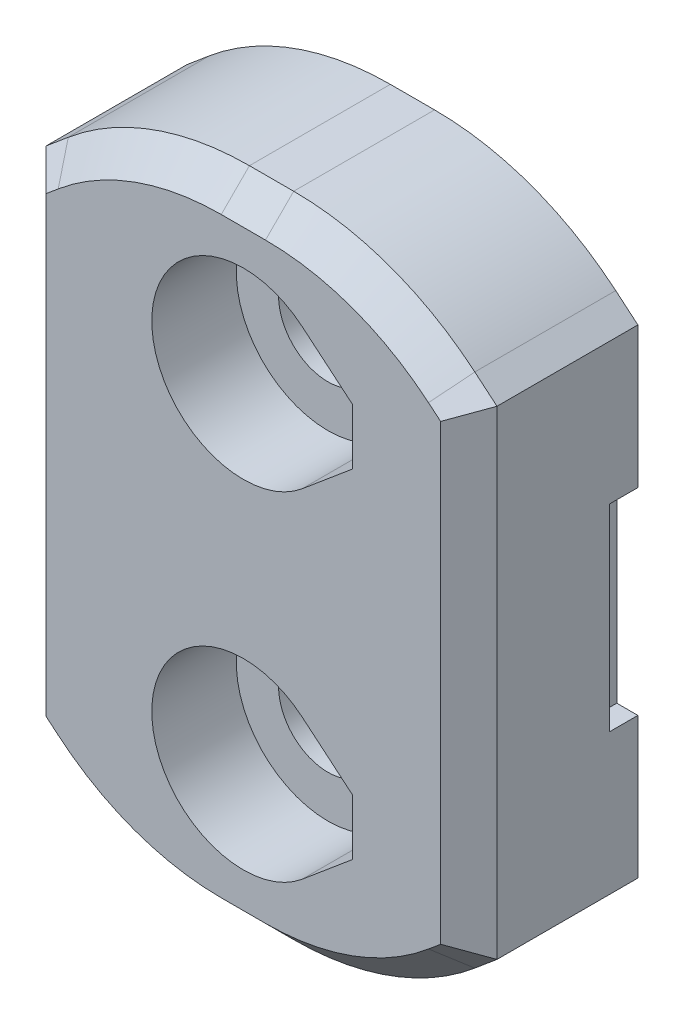
from build123d import *
from OCP.BRepFilletAPI import BRepFilletAPI_MakeChamfer

# Parameters (mm, degrees)
CROQUIS2_W              = 16
CROQUIS2_H              = 23
SALIENTE_EXTRUIR1_DEPTH = 6
CORTAR_EXTRUIR1_DEPTH   = 3
CHAFL_N2_SIZE           = 3
CHAFL_N2_SIZE2          = 3.575260778
REDONDEO1_R             = 10
CHAFL_N1_SIZE           = 1
CROQUIS4_W              = 16
CROQUIS4_H              = 7
CORTAR_EXTRUIR2_DEPTH   = 1
SALIENTE_EXTRUIR2_DEPTH = 7
MATRIZL1_COUNT          = 8
MATRIZL1_PITCH          = 2


with BuildPart() as part:
    # Croquis2 → Saliente-Extruir1 (new body)
    with BuildSketch(Plane(origin=(0, 0, 0), x_dir=(-1, 0, 0), z_dir=(0, 0, -1))):
        with Locations((-8, 11.5)):
            Rectangle(CROQUIS2_W, CROQUIS2_H)
        with BuildLine():
            Line((-9.977670702, 6.125), (-9.977670702, 4.875))
            Line((-9.977670702, 4.875), (-9.124878317, 4.159422225))
            ThreePointArc((-9.124878317, 4.159422225), (-6.25, 5.5), (-9.124878317, 6.840577775))
            Line((-9.124878317, 6.840577775), (-9.977670702, 6.125))
        make_face(mode=Mode.SUBTRACT)
        with BuildLine():
            Line((-9.977670702, 18.125), (-9.977670702, 16.875))
            Line((-9.977670702, 16.875), (-9.124878317, 16.159422225))
            ThreePointArc((-9.124878317, 16.159422225), (-6.25, 17.5), (-9.124878317, 18.840577775))
            Line((-9.124878317, 18.840577775), (-9.977670702, 18.125))
        make_face(mode=Mode.SUBTRACT)
    extrude(amount=SALIENTE_EXTRUIR1_DEPTH)

    # Croquis3 → Cortar-Extruir1 (cut)
    with BuildSketch(Plane(origin=(-8, 0, 0), x_dir=(-1, 0, 0), z_dir=(0, 0, -1))):
        with BuildLine():
            Line((-19.864348845, 6.5), (-19.864348845, 4.5))
            Line((-19.864348845, 4.5), (-18.089059731, 3.01035556))
            ThreePointArc((-18.089059731, 3.01035556), (-12.75, 5.5), (-18.089059731, 7.98964444))
            Line((-18.089059731, 7.98964444), (-19.864348845, 6.5))
        make_face()
        with BuildLine():
            Line((-19.864348845, 18.5), (-18.089059731, 19.98964444))
            ThreePointArc((-18.089059731, 19.98964444), (-12.75, 17.5), (-18.089059731, 15.01035556))
            Line((-18.089059731, 15.01035556), (-19.864348845, 16.5))
            Line((-19.864348845, 16.5), (-19.864348845, 18.5))
        make_face()
    extrude(amount=CORTAR_EXTRUIR1_DEPTH, mode=Mode.SUBTRACT)

    # Chaflán2: one chamfer whose edges measure the first distance from different faces: ONE call of the kernel's chamfer builder (chamfer() names one face for all edges)
    chafl_n2_edges_1 = [part.edges().sort_by_distance(p)[0] for p in [
        (16, 23, -3),
        (16, 0, -3),
    ]]
    chafl_n2_side_1 = [part.faces().sort_by_distance(p)[0] for p in [
        (16, 11.5, -3),
    ]]
    chafl_n2_edges_2 = [part.edges().sort_by_distance(p)[0] for p in [
        (0, 23, -3),
        (0, 0, -3),
    ]]
    chafl_n2_side_2 = [part.faces().sort_by_distance(p)[0] for p in [
        (0, 11.5, -3),
    ]]
    chafl_n2 = BRepFilletAPI_MakeChamfer(part.part.solid().wrapped)
    for e in chafl_n2_edges_1:
        chafl_n2.Add(CHAFL_N2_SIZE, CHAFL_N2_SIZE2, e.wrapped, chafl_n2_side_1[0].wrapped)  # the first distance lies on this face
    for e in chafl_n2_edges_2:
        chafl_n2.Add(CHAFL_N2_SIZE, CHAFL_N2_SIZE2, e.wrapped, chafl_n2_side_2[0].wrapped)  # the first distance lies on this face
    add(Compound.cast(chafl_n2.Shape()), mode=Mode.REPLACE)

    # Redondeo1
    redondeo1_edges = [part.edges().sort_by_distance(p)[0] for p in [
        (3.575260778, 23, -3),
        (12.424739222, 23, -3),
        (3.575260778, 0, -3),
        (12.424739222, 0, -3),
    ]]
    fillet(redondeo1_edges, radius=REDONDEO1_R)

    # Chaflán1
    chafl_n1_edges = [part.edges().sort_by_distance(p)[0] for p in [
        (8, 0, 0),
        (8, 23, 0),
        (0.393543512, 20.330222216, 0),
        (15.606456488, 2.669777784, 0),
        (3.794761687, 22.396926208, 0),
        (12.205238313, 22.396926208, 0),
        (12.205238313, 0.603073792, 0),
        (3.794761687, 0.603073792, 0),
        (16, 11.5, 0),
        (0, 11.5, 0),
        (0.393543512, 2.669777784, 0),
        (15.606456488, 20.330222216, 0),
    ]]
    chamfer(chafl_n1_edges, length=CHAFL_N1_SIZE)

    # Croquis4 → Cortar-Extruir2 (cut)
    with BuildSketch(Plane(origin=(0, 0, -6), x_dir=(-1, 0, 0), z_dir=(0, 0, -1))):
        with Locations((-8, 11.5)):
            Rectangle(CROQUIS4_W, CROQUIS4_H)
    extrude(amount=-CORTAR_EXTRUIR2_DEPTH, mode=Mode.SUBTRACT)

    # Croquis5 → Saliente-Extruir2 (add)
    with BuildSketch(Plane(origin=(0, 8, 0), x_dir=(1, 0, 0), z_dir=(0, 1, 0))):
        Polygon((0, 5), (0.839099631, 6), (1.25, 6), (1.25, 5), align=None)
    saliente_extruir2 = extrude(amount=SALIENTE_EXTRUIR2_DEPTH)

    # MatrizL1: Saliente-Extruir2 ×8
    with Locations(*[(i * MATRIZL1_PITCH, 0, 0) for i in range(1, MATRIZL1_COUNT)]):
        add(saliente_extruir2)


solid = part.part
